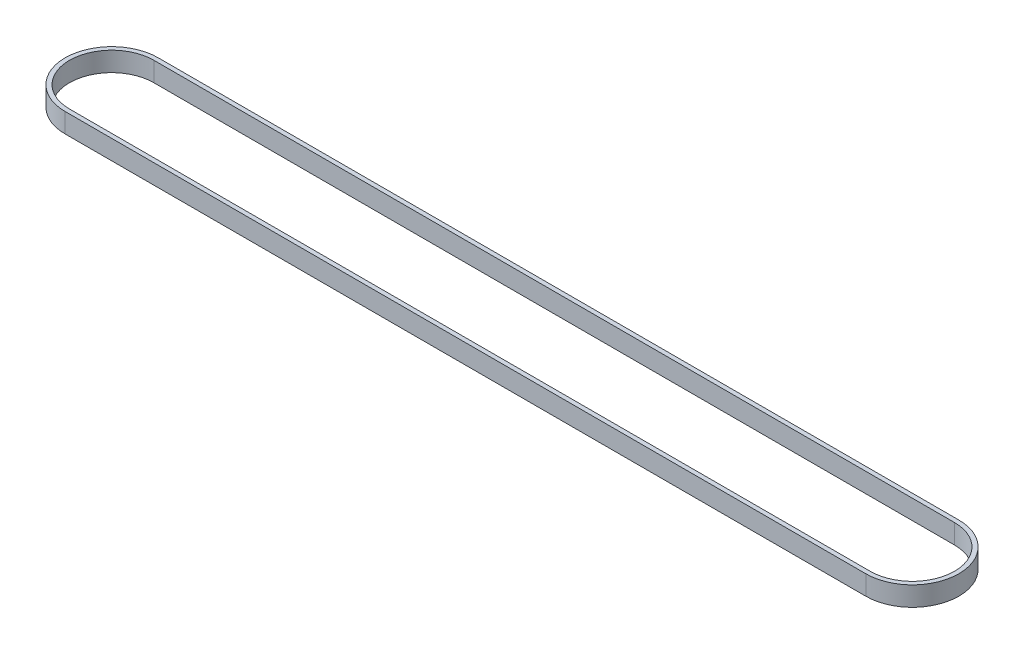
from build123d import *

# Parameters (mm, degrees)
ESTRUSIONE_ESTRUSIONE1_DEPTH = 4.5


with BuildPart() as part:
    # Schizzo1 → Estrusione-Estrusione1 (new, symmetric)
    with BuildSketch(Plane(origin=(0, 0, 0), x_dir=(1, 0, 0), z_dir=(0, 1, 0))):
        with BuildLine():
            Line((-185, 21.5), (185, 21.5))
            ThreePointArc((185, 21.5), (206.5, 0), (185, -21.5))
            Line((185, -21.5), (-185, -21.5))
            ThreePointArc((-185, -21.5), (-206.5, 0), (-185, 21.5))
        make_face()
        with BuildLine():
            Line((-185, 19.5), (185, 19.5))
            ThreePointArc((185, 19.5), (204.5, 0), (185, -19.5))
            Line((185, -19.5), (-185, -19.5))
            ThreePointArc((-185, -19.5), (-204.5, 0), (-185, 19.5))
        make_face(mode=Mode.SUBTRACT)
    extrude(amount=ESTRUSIONE_ESTRUSIONE1_DEPTH, both=True)


solid = part.part
